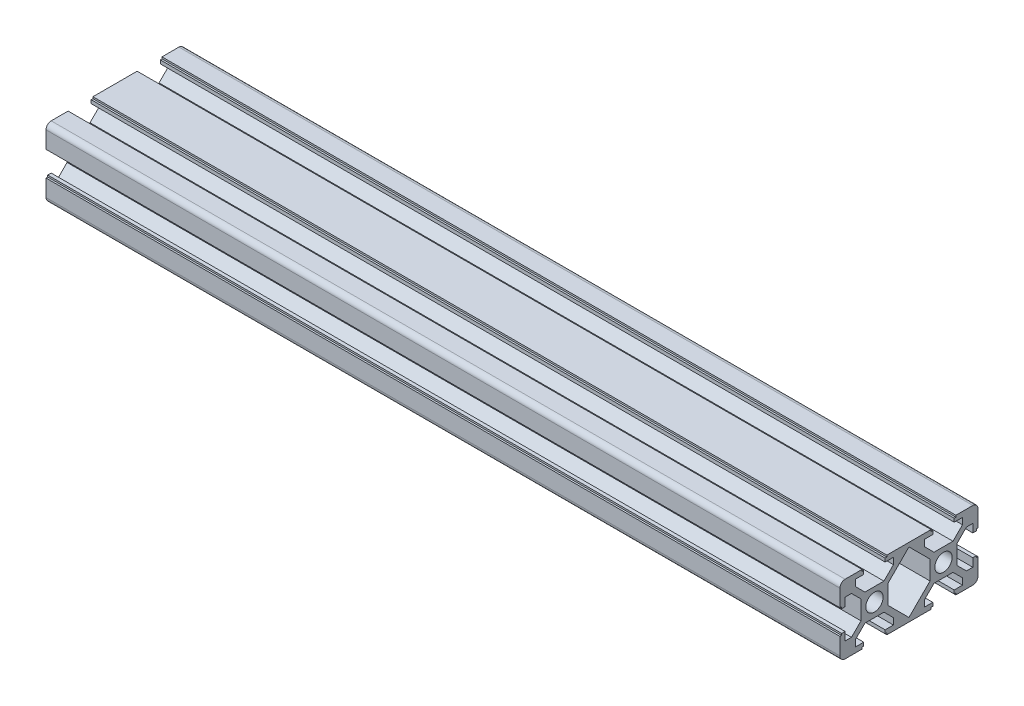
from build123d import *

# Parameters (mm, degrees)
SKETCH16_R           = 2.5
F_20X40XR1_5_2_DEPTH = 230


with BuildPart() as part:
    # Sketch16 → 铝型材 20X40XR1.5(2) (new body)
    with BuildSketch(Plane(origin=(-53.342500755, -1.452155193, 0), x_dir=(0, 1, 0), z_dir=(1, 0, 0))):
        with BuildLine():
            Line((-3.6, 10), (-3.6, 9.5))
            Line((-3.6, 9.5), (-3.1, 9.5))
            Line((-3.1, 9.5), (-3.1, 8.5))
            Line((-3.1, 8.5), (-5.5, 8.5))
            Line((-5.5, 8.5), (-5.5, 6.65))
            Line((-5.5, 6.65), (-2.75, 3.9))
            Line((-2.75, 3.9), (2.75, 3.9))
            Line((2.75, 3.9), (5.5, 6.65))
            Line((5.5, 6.65), (5.5, 8.5))
            Line((5.5, 8.5), (3.1, 8.5))
            Line((3.1, 8.5), (3.1, 9.5))
            Line((3.1, 9.5), (3.6, 9.5))
            Line((3.6, 9.5), (3.6, 10))
            Line((3.6, 10), (8.5, 10))
            ThreePointArc((8.5, 10), (9.560660172, 9.560660172), (10, 8.5))
            Line((10, 8.5), (10, 3.6))
            Line((10, 3.6), (9.5, 3.6))
            Line((9.5, 3.6), (9.5, 3.1))
            Line((9.5, 3.1), (8.5, 3.1))
            Line((8.5, 3.1), (8.5, 5.5))
            Line((8.5, 5.5), (6.65, 5.5))
            Line((6.65, 5.5), (3.9, 2.75))
            Line((3.9, 2.75), (3.9, -2.75))
            Line((3.9, -2.75), (6.65, -5.5))
            Line((6.65, -5.5), (8.5, -5.5))
            Line((8.5, -5.5), (8.5, -3.1))
            Line((8.5, -3.1), (9.5, -3.1))
            Line((9.5, -3.1), (9.5, -3.6))
            Line((9.5, -3.6), (10, -3.6))
            Line((10, -3.6), (10, -16.4))
            Line((10, -16.4), (9.5, -16.4))
            Line((9.5, -16.4), (9.5, -16.9))
            Line((9.5, -16.9), (8.5, -16.9))
            Line((8.5, -16.9), (8.5, -14.5))
            Line((8.5, -14.5), (6.65, -14.5))
            Line((6.65, -14.5), (3.9, -17.25))
            Line((3.9, -17.25), (3.9, -22.75))
            Line((3.9, -22.75), (6.65, -25.5))
            Line((6.65, -25.5), (8.5, -25.5))
            Line((8.5, -25.5), (8.5, -23.1))
            Line((8.5, -23.1), (9.5, -23.1))
            Line((9.5, -23.1), (9.5, -23.6))
            Line((9.5, -23.6), (10, -23.6))
            Line((10, -23.6), (10, -28.5))
            ThreePointArc((10, -28.5), (9.560660172, -29.560660172), (8.5, -30))
            Line((8.5, -30), (3.6, -30))
            Line((3.6, -30), (3.6, -29.5))
            Line((3.6, -29.5), (3.1, -29.5))
            Line((3.1, -29.5), (3.1, -28.5))
            Line((3.1, -28.5), (5.5, -28.5))
            Line((5.5, -28.5), (5.5, -26.65))
            Line((5.5, -26.65), (2.75, -23.9))
            Line((2.75, -23.9), (-2.75, -23.9))
            Line((-2.75, -23.9), (-5.5, -26.65))
            Line((-5.5, -26.65), (-5.5, -28.5))
            Line((-5.5, -28.5), (-3.1, -28.5))
            Line((-3.1, -28.5), (-3.1, -29.5))
            Line((-3.1, -29.5), (-3.6, -29.5))
            Line((-3.6, -29.5), (-3.6, -30))
            Line((-3.6, -30), (-8.5, -30))
            ThreePointArc((-8.5, -30), (-9.560660172, -29.560660172), (-10, -28.5))
            Line((-10, -28.5), (-10, -23.6))
            Line((-10, -23.6), (-9.5, -23.6))
            Line((-9.5, -23.6), (-9.5, -23.1))
            Line((-9.5, -23.1), (-8.5, -23.1))
            Line((-8.5, -23.1), (-8.5, -25.5))
            Line((-8.5, -25.5), (-6.65, -25.5))
            Line((-6.65, -25.5), (-3.9, -22.75))
            Line((-3.9, -22.75), (-3.9, -17.25))
            Line((-3.9, -17.25), (-6.65, -14.5))
            Line((-6.65, -14.5), (-8.5, -14.5))
            Line((-8.5, -14.5), (-8.5, -16.9))
            Line((-8.5, -16.9), (-9.5, -16.9))
            Line((-9.5, -16.9), (-9.5, -16.4))
            Line((-9.5, -16.4), (-10, -16.4))
            Line((-10, -16.4), (-10, -3.6))
            Line((-10, -3.6), (-9.5, -3.6))
            Line((-9.5, -3.6), (-9.5, -3.1))
            Line((-9.5, -3.1), (-8.5, -3.1))
            Line((-8.5, -3.1), (-8.5, -5.5))
            Line((-8.5, -5.5), (-6.65, -5.5))
            Line((-6.65, -5.5), (-3.9, -2.75))
            Line((-3.9, -2.75), (-3.9, 2.75))
            Line((-3.9, 2.75), (-6.65, 5.5))
            Line((-6.65, 5.5), (-8.5, 5.5))
            Line((-8.5, 5.5), (-8.5, 3.1))
            Line((-8.5, 3.1), (-9.5, 3.1))
            Line((-9.5, 3.1), (-9.5, 3.6))
            Line((-9.5, 3.6), (-10, 3.6))
            Line((-10, 3.6), (-10, 8.5))
            ThreePointArc((-10, 8.5), (-9.560660172, 9.560660172), (-8.5, 10))
            Line((-8.5, 10), (-3.6, 10))
        make_face()
        Circle(SKETCH16_R, mode=Mode.SUBTRACT)
        with Locations((0, -20)):
            Circle(SKETCH16_R, mode=Mode.SUBTRACT)
        Polygon((8.85, -10), (2.75, -3.9), (-2.75, -3.9), (-8.85, -10), (-2.75, -16.1), (2.75, -16.1), align=None, mode=Mode.SUBTRACT)
    extrude(amount=F_20X40XR1_5_2_DEPTH)


solid = part.part
